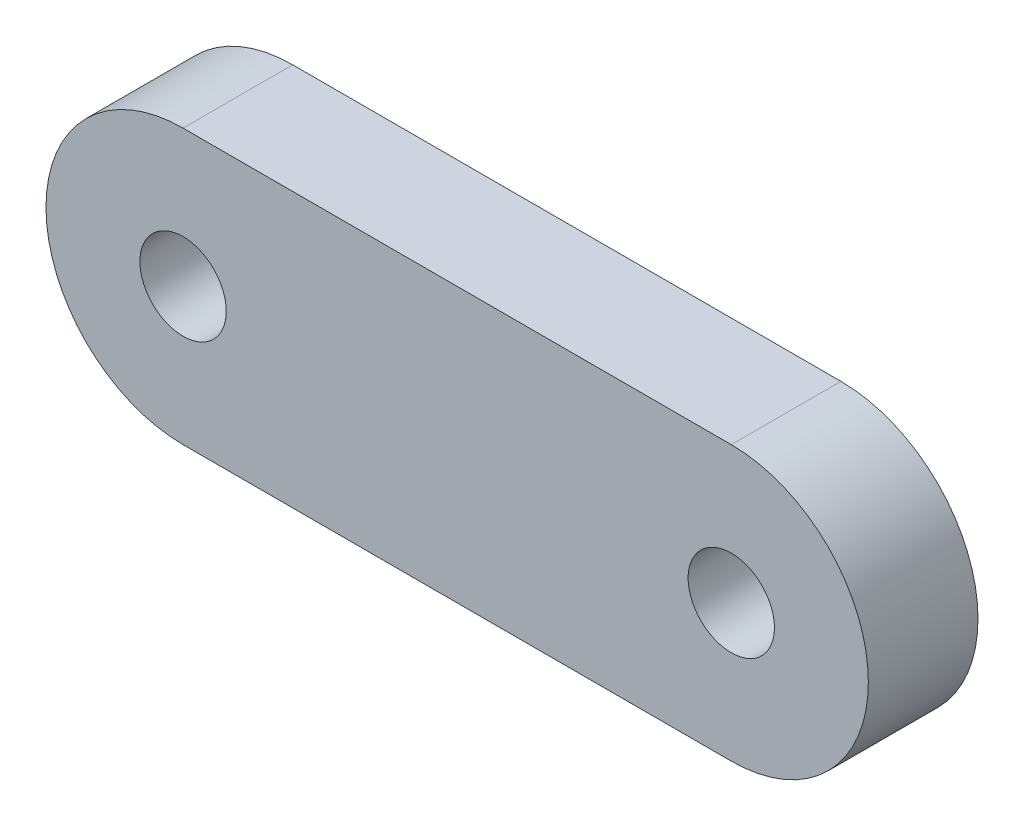
from build123d import *

# Parameters (mm, degrees)
SKETCH1_R           = 2
BOSS_EXTRUDE1_DEPTH = 5.08


with BuildPart() as part:
    # Sketch1 → Boss-Extrude1 (new body)
    with BuildSketch(Plane.XY):
        with BuildLine():
            Line((0, 6.35), (25.4, 6.35))
            ThreePointArc((25.4, 6.35), (31.75, 0), (25.4, -6.35))
            Line((25.4, -6.35), (0, -6.35))
            ThreePointArc((0, -6.35), (-6.35, 0), (0, 6.35))
        make_face()
        Circle(SKETCH1_R, mode=Mode.SUBTRACT)
        with Locations((25.4, 0)):
            Circle(SKETCH1_R, mode=Mode.SUBTRACT)
    extrude(amount=BOSS_EXTRUDE1_DEPTH)


solid = part.part
